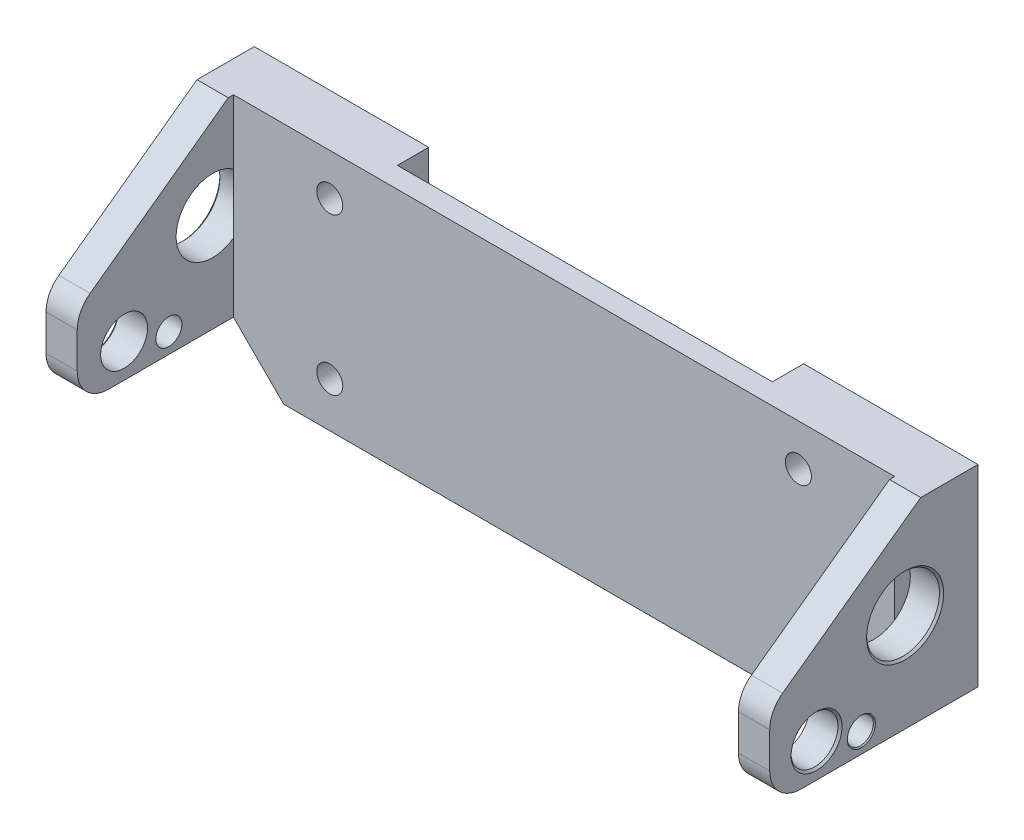
from build123d import *

# Parameters (mm, degrees)
SKETCH_1_W             = 63.5
SKETCH_1_H             = 24
EXTRUDE_1_DEPTH        = 5.5
SKETCH_2_W             = 35
SKETCH_2_H             = 3
CUT_EXTRUDE_2_DEPTH    = 24
HOLE_WIZARD_M3_1_D     = 2.5
HOLE_WIZARD_M3_1_DEPTH = 7.5
HOLE_WIZARD_M3_1_TIP   = 0.751075774
CHAMFER_1_SIZE         = 0.5
CHAMFER_2_SIZE         = 0.5
CHAMFER_3_SIZE         = 5.5
SKETCH_7_W             = 20
SKETCH_7_H             = 18.5
EXTRUDE_1_2_DEPTH      = 3
SKETCH_8_R             = 3.5
CUT_EXTRUDE_1_DEPTH    = 3
SKETCH_9_R             = 2.25
CUT_EXTRUDE_2_2_DEPTH  = 87
CUT_EXTRUDE_4_DEPTH    = 10
FILLET_1_R             = 3
CHAMFER_5_SIZE         = 0.2
FILLET_3_R             = 2
SKETCH_11_R            = 1.25
CUT_EXTRUDE_5_DEPTH    = 96
CHAMFER_6_SIZE         = 0.1
SKETCH_12_W            = 35
SKETCH_12_H            = 24
EXTRUDE_2_DEPTH        = 3
SKETCH_13_W            = 36
SKETCH_13_H            = 24
CUT_EXTRUDE_6_DEPTH    = 3
CUT_EXTRUDE_7_DEPTH    = 0.5


with BuildPart() as part:
    # 草图1 → Extrude 1 (new body)
    with BuildSketch(Plane.XY):
        Rectangle(SKETCH_1_W, SKETCH_1_H)
    extrude(amount=EXTRUDE_1_DEPTH)

    # 草图2 → Cut-Extrude 2 (cut)
    with BuildSketch(Plane.XZ.offset(12)):
        with Locations((0, 1.5)):
            Rectangle(SKETCH_2_W, SKETCH_2_H)
    extrude(amount=-CUT_EXTRUDE_2_DEPTH, mode=Mode.SUBTRACT)

    # M3 螺纹孔1
    with Locations(Plane(origin=(22.5, 8, 0), x_dir=(-1, 0, 0), z_dir=(0, 0, -1))):
        with Locations((0, 0), (0, -15), (45, -15), (45, 0)):
            Hole(HOLE_WIZARD_M3_1_D / 2, depth=HOLE_WIZARD_M3_1_DEPTH)
            with Locations((0, 0, -(HOLE_WIZARD_M3_1_DEPTH + HOLE_WIZARD_M3_1_TIP / 2))):  # 118° drill point
                Cone(0, HOLE_WIZARD_M3_1_D / 2, HOLE_WIZARD_M3_1_TIP, mode=Mode.SUBTRACT)

    # 倒角1
    chamfer_1_edges = [part.edges().sort_by_distance(p)[0] for p in [
        (-23.75, 8, 0),
        (-23.75, -7, 0),
        (21.25, -7, 0),
        (21.25, 8, 0),
    ]]
    chamfer(chamfer_1_edges, length=CHAMFER_1_SIZE)

    # 倒角2
    chamfer_2_edges = [part.edges().sort_by_distance(p)[0] for p in [
        (-23.75, 8, 5.5),
        (-23.75, -7, 5.5),
        (21.25, -7, 5.5),
        (21.25, 8, 5.5),
    ]]
    chamfer(chamfer_2_edges, length=CHAMFER_2_SIZE)

    # 倒角3
    chamfer_3_edges = [part.edges().sort_by_distance(p)[0] for p in [
        (31.75, -12, 2.75),
        (-31.75, -12, 2.75),
    ]]
    chamfer(chamfer_3_edges, length=CHAMFER_3_SIZE)

    # 草图7 → Extrude 1 2 (add)
    with BuildSketch(Plane(origin=(31.75, 0, 0), x_dir=(0, 0, -1), z_dir=(1, 0, 0))):
        with Locations((-10, 2.75)):
            Rectangle(SKETCH_7_W, SKETCH_7_H)
    extrude_1_2 = extrude(amount=EXTRUDE_1_2_DEPTH)

    # 草图8 → 切除-拉伸1 (cut)
    with BuildSketch(Plane(origin=(34.75, 0, 0), x_dir=(0, 0, -1), z_dir=(1, 0, 0))):
        with Locations((-7, 2.95)):
            Circle(SKETCH_8_R)
    cut_extrude_1 = extrude(amount=-CUT_EXTRUDE_1_DEPTH, mode=Mode.SUBTRACT)

    # 草图9 → Cut-Extrude 2 2 (cut)
    with BuildSketch(Plane(origin=(34.75, 0, 0), x_dir=(0, 0, -1), z_dir=(1, 0, 0))):
        with Locations((-15.5, -3.25)):
            Circle(SKETCH_9_R)
    cut_extrude_2_2 = extrude(amount=-CUT_EXTRUDE_2_2_DEPTH, mode=Mode.SUBTRACT)

    # 草图10 → 切除-拉伸4 (cut)
    with BuildSketch(Plane(origin=(31.75, 0, 0), x_dir=(0, 0, -1), z_dir=(1, 0, 0))):
        Polygon((-20, 1.465133344), (-20, 12), (-5.5, 12), align=None)
    cut_extrude_4 = extrude(amount=CUT_EXTRUDE_4_DEPTH, mode=Mode.SUBTRACT)

    # 镜向2: Extrude 1 2, 切除-拉伸1, Cut-Extrude 2 2, 切除-拉伸4 across plane
    add(extrude_1_2.mirror(Plane(origin=(0, 0, 0), x_dir=(0, 0, 1), z_dir=(1, 0, 0))))
    add(cut_extrude_1.mirror(Plane(origin=(0, 0, 0), x_dir=(0, 0, 1), z_dir=(1, 0, 0))), mode=Mode.SUBTRACT)
    add(cut_extrude_2_2.mirror(Plane(origin=(0, 0, 0), x_dir=(0, 0, 1), z_dir=(1, 0, 0))), mode=Mode.SUBTRACT)
    add(cut_extrude_4.mirror(Plane(origin=(0, 0, 0), x_dir=(0, 0, 1), z_dir=(1, 0, 0))), mode=Mode.SUBTRACT)

    # 圆角1
    fillet_1_edges = [part.edges().sort_by_distance(p)[0] for p in [
        (33.25, -6.5, 20),
        (33.25, 1.465133344, 20),
        (-33.25, 1.465133344, 20),
        (-33.25, -6.5, 20),
    ]]
    fillet(fillet_1_edges, radius=FILLET_1_R)

    # 倒角5
    chamfer_5_edges = [part.edges().sort_by_distance(p)[0] for p in [
        (34.75, 2.95, 10.5),
        (34.75, -3.25, 17.75),
        (-34.75, 2.95, 10.5),
        (-34.75, -3.25, 17.75),
    ]]
    chamfer(chamfer_5_edges, length=CHAMFER_5_SIZE)

    # 圆角3
    fillet_3_edges = [part.edges().sort_by_distance(p)[0] for p in [
        (0, -12, 5.5),
    ]]
    fillet(fillet_3_edges, radius=FILLET_3_R)

    # 草图11 → 切除-拉伸5 (cut)
    with BuildSketch(Plane.ZY.offset(34.75)):
        with Locations((11.2, -4.6)):
            Circle(SKETCH_11_R)
    extrude(amount=-CUT_EXTRUDE_5_DEPTH, mode=Mode.SUBTRACT)

    # 倒角6
    chamfer_6_edges = [part.edges().sort_by_distance(p)[0] for p in [
        (34.75, -4.6, 9.95),
        (-34.75, -4.6, 9.95),
    ]]
    chamfer(chamfer_6_edges, length=CHAMFER_6_SIZE)

    # 草图12 → 凸台-拉伸2 (add)
    with BuildSketch(Plane(origin=(0, 0, 3), x_dir=(-1, 0, 0), z_dir=(0, 0, -1))):
        Rectangle(SKETCH_12_W, SKETCH_12_H)
    extrude(amount=EXTRUDE_2_DEPTH)

    # 草图13 → 切除-拉伸6 (cut)
    with BuildSketch(Plane(origin=(0, 0, 0), x_dir=(-1, 0, 0), z_dir=(0, 0, -1))):
        Rectangle(SKETCH_13_W, SKETCH_13_H)
    extrude(amount=-CUT_EXTRUDE_6_DEPTH, mode=Mode.SUBTRACT)

    # 草图14 → 切除-拉伸7 (cut)
    with BuildSketch(Plane.XY.offset(5.5)):
        Polygon((31.75, -6.5), (25.25, -13), (-25.25, -13), (-31.75, -6.5), (-31.75, 12), (31.75, 12), align=None)
    extrude(amount=-CUT_EXTRUDE_7_DEPTH, mode=Mode.SUBTRACT)


solid = part.part
